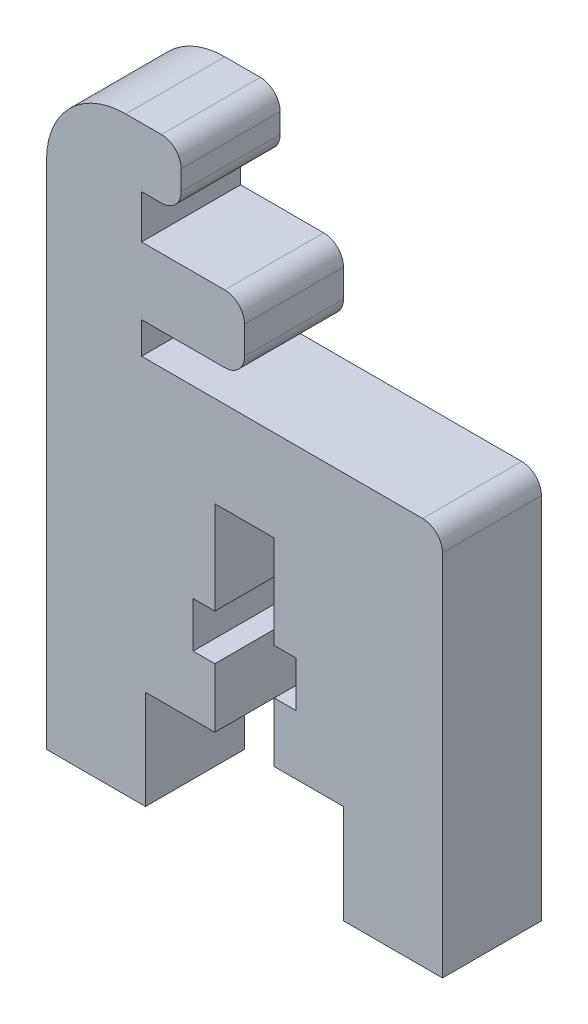
from build123d import *

# Parameters (mm, degrees)
BOSS_EXTRUDE1_DEPTH = 5
FILLET3_R           = 1
FILLET4_R           = 1
FILLET5_R           = 4


with BuildPart() as part:
    # Sketch1 → Boss-Extrude1 (new body)
    with BuildSketch(Plane.XY):
        Polygon((0, 5), (0, 19.982808697), (0, 24.6), (0, 29.8), (6.8, 29.8), (6.8, 26.8), (4.8, 26.8), (4.8, 24.6), (10, 24.6), (10, 21.2), (4.8, 21.2), (4.8, 19.6), (20, 19.6), (20, 5), (20, 0), (15, 0), (15, 5), (11.5, 5), (11.5, 8), (12.6, 8), (12.6, 10.3), (11.5, 10.3), (11.5, 15), (8.5, 15), (8.5, 10.3), (7.4, 10.3), (7.4, 8), (8.5, 8), (8.5, 5), (5, 5), (5, 0), (0, 0), align=None)
    extrude(amount=BOSS_EXTRUDE1_DEPTH)

    # Fillet3
    fillet3_edges = [part.edges().sort_by_distance(p)[0] for p in [
        (10, 21.2, 2.5),
        (20, 19.6, 2.5),
    ]]
    fillet(fillet3_edges, radius=FILLET3_R)

    # Fillet4
    fillet4_edges = [part.edges().sort_by_distance(p)[0] for p in [
        (6.8, 29.8, 2.5),
        (6.8, 26.8, 2.5),
        (10, 24.6, 2.5),
    ]]
    fillet(fillet4_edges, radius=FILLET4_R)

    # Fillet5
    fillet5_edges = [part.edges().sort_by_distance(p)[0] for p in [
        (0, 29.8, 2.5),
    ]]
    fillet(fillet5_edges, radius=FILLET5_R)


solid = part.part
